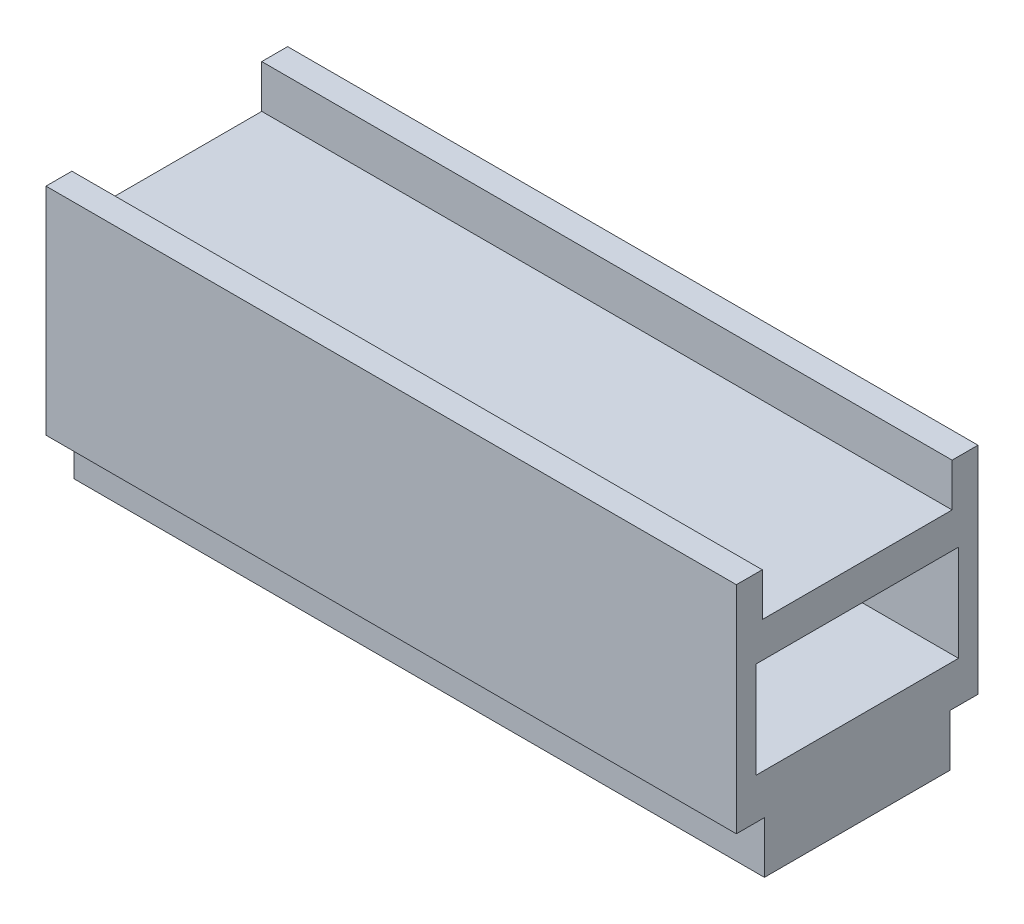
from build123d import *

# Parameters (mm, degrees)
SKETCH1_W           = 80
SKETCH1_H           = 21.5
BOSS_EXTRUDE1_DEPTH = 6
SKETCH2_W           = 80
SKETCH2_H           = 28
BOSS_EXTRUDE2_DEPTH = 25
SKETCH3_W           = 80
SKETCH3_H           = 22
CUT_EXTRUDE1_DEPTH  = 5
CUT_EXTRUDE2_REACH  = 88.931
SKETCH4_W           = 23.48673248
SKETCH4_H           = 11.163179787


with BuildPart() as part:
    # Sketch1 → Boss-Extrude1 (new body)
    with BuildSketch(Plane(origin=(0, 0, 0), x_dir=(1, 0, 0), z_dir=(0, 1, 0))):
        Rectangle(SKETCH1_W, SKETCH1_H)
    extrude(amount=BOSS_EXTRUDE1_DEPTH)

    # Sketch2 → Boss-Extrude2 (add)
    with BuildSketch(Plane(origin=(0, 6, 0), x_dir=(1, 0, 0), z_dir=(0, 1, 0))):
        Rectangle(SKETCH2_W, SKETCH2_H)
    extrude(amount=BOSS_EXTRUDE2_DEPTH)

    # Sketch3 → Cut-Extrude1 (cut)
    with BuildSketch(Plane(origin=(0, 31, 0), x_dir=(1, 0, 0), z_dir=(0, 1, 0))):
        Rectangle(SKETCH3_W, SKETCH3_H)
    extrude(amount=-CUT_EXTRUDE1_DEPTH, mode=Mode.SUBTRACT)

    # Sketch4 → Cut-Extrude2 (cut, up to next)
    with BuildSketch(Plane(origin=(40, 0, 0), x_dir=(0, 0, -1), z_dir=(1, 0, 0)), mode=Mode.PRIVATE) as cut_extrude2_sk1:
        with Locations((0, 16.319081307)):
            Rectangle(SKETCH4_W, SKETCH4_H)
    cut_extrude2_tool1 = extrude(cut_extrude2_sk1.sketch, amount=-CUT_EXTRUDE2_REACH, mode=Mode.PRIVATE) & part.part
    add(cut_extrude2_tool1.solids().sort_by_distance((40, 16.319081, 0))[0], mode=Mode.SUBTRACT)


solid = part.part
